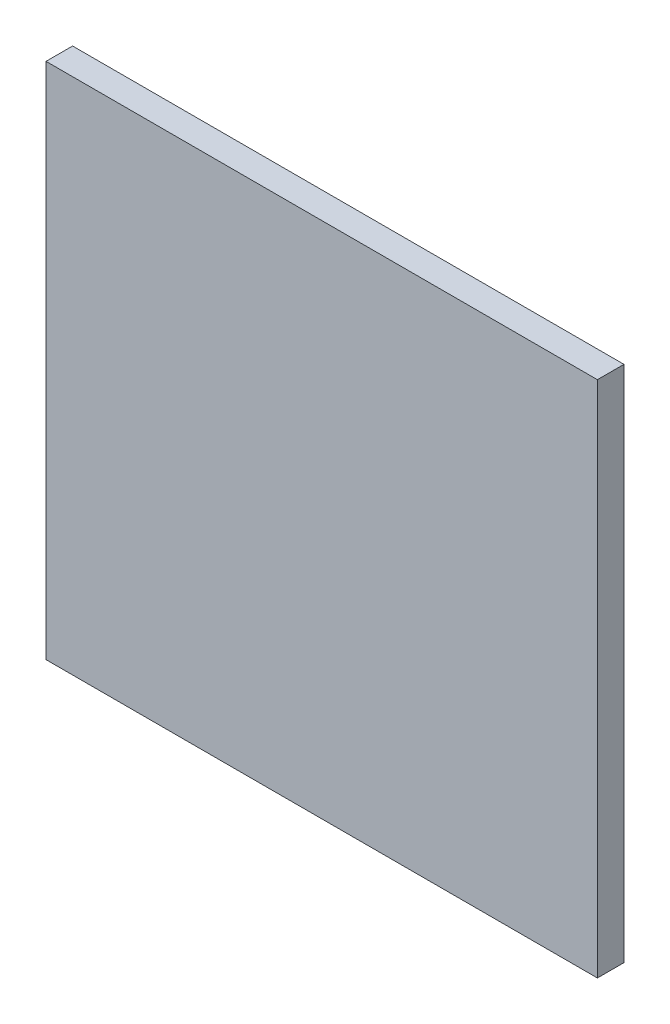
from build123d import *

# Parameters (mm, degrees)
SKETCH1_W           = 41.5
SKETCH1_H           = 39
BOSS_EXTRUDE1_DEPTH = 2


with BuildPart() as part:
    # Sketch1 → Boss-Extrude1 (new body)
    with BuildSketch(Plane.XY):
        with Locations((20.75, 19.5)):
            Rectangle(SKETCH1_W, SKETCH1_H)
    extrude(amount=BOSS_EXTRUDE1_DEPTH)


solid = part.part
